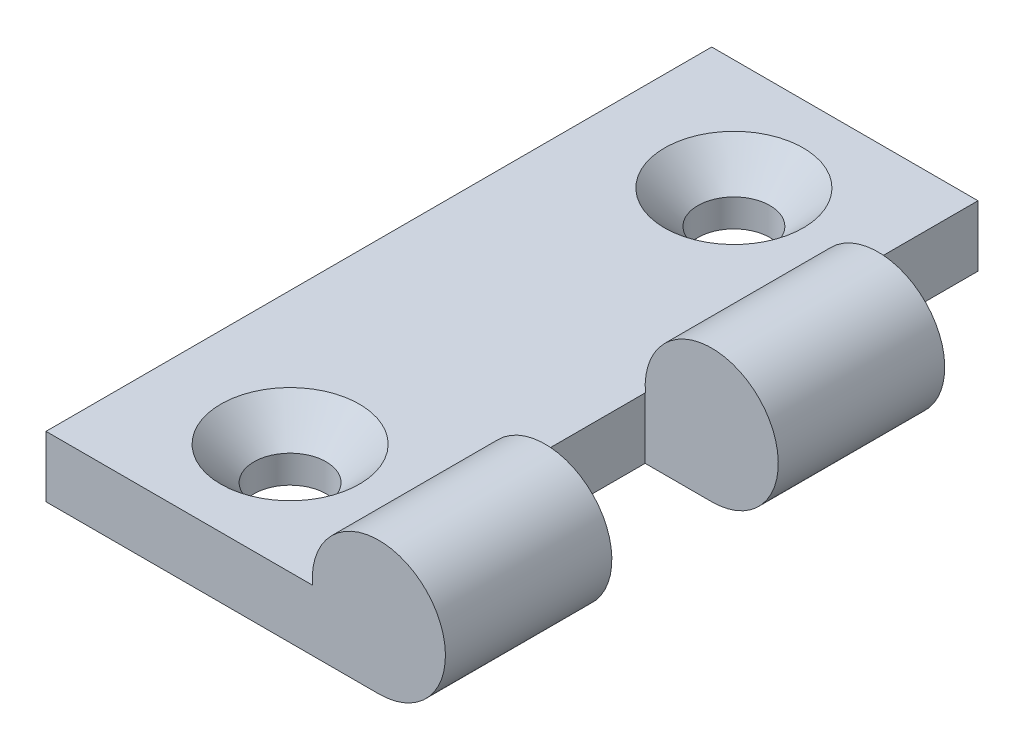
from build123d import *

# Parameters (mm, degrees)
EXTRUDE_1_DEPTH          = 60
CUT_EXTRUDE_1_DEPTH      = 71.272683171
CUT_EXTRUDE_1_DEPTH_BACK = 71.272683171
SKETCH_2_W               = 12
SKETCH_2_H               = 15
SKETCH_3_R               = 3.25
CUT_EXTRUDE_2_DEPTH      = 10
CHAMFER_1_SIZE           = 3


with BuildPart() as part:
    # 草图1 → 凸台-拉伸1 (new body)
    with BuildSketch(Plane.XY):
        with BuildLine():
            Line((0, 0), (30, 0))
            ThreePointArc((30, 0), (34.062019202, 10.415880433), (24.020869628, 5.5))
            Line((24.020869628, 5.5), (0, 5.5))
            Line((0, 5.5), (0, 0))
        make_face()
    extrude(amount=-EXTRUDE_1_DEPTH)

    # 草图2 → 切除-拉伸1 (cut, two sides: drawn at the far end of the back side and taken through both)
    with BuildSketch(Plane(origin=(0, 5.5, 0), x_dir=(1, 0, 0), z_dir=(0, 1, 0)).offset(-CUT_EXTRUDE_1_DEPTH_BACK)):
        with Locations((30, 52.5)):
            Rectangle(SKETCH_2_W, SKETCH_2_H)
        with Locations((30, 22.5)):
            Rectangle(SKETCH_2_W, SKETCH_2_H)
    extrude(amount=CUT_EXTRUDE_1_DEPTH + CUT_EXTRUDE_1_DEPTH_BACK, mode=Mode.SUBTRACT)

    # 草图3 → 切除-拉伸2 (cut)
    with BuildSketch(Plane(origin=(0, 5.5, 0), x_dir=(1, 0, 0), z_dir=(0, 1, 0))):
        with Locations(Location((12, 50, 0), (0, 0, 270))):
            Circle(SKETCH_3_R)
        with Locations(Location((12, 10, 0), (0, 0, 90))):
            Circle(SKETCH_3_R)
    extrude(amount=-CUT_EXTRUDE_2_DEPTH, mode=Mode.SUBTRACT)

    # 倒角1
    chamfer_1_edges = [part.edges().sort_by_distance(p)[0] for p in [
        (12, 5.5, -53.25),
        (12, 5.5, -6.75),
    ]]
    chamfer(chamfer_1_edges, length=CHAMFER_1_SIZE)


solid = part.part
